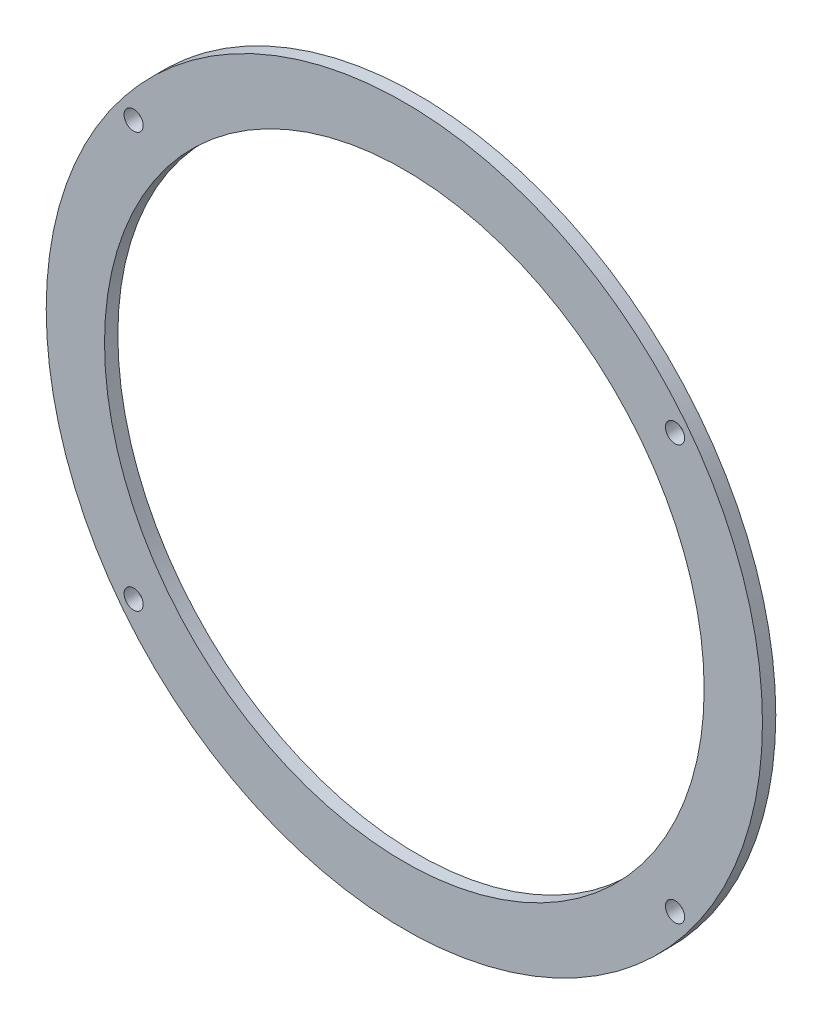
from build123d import *

# Parameters (mm, degrees)
SKETCH1_R           = 43
SKETCH1_R_2         = 36
SKETCH1_R_3         = 1.15
BOSS_EXTRUDE2_DEPTH = 1.6
SKETCH4_W           = 1.2
SKETCH4_H           = 2.3
BOSS_EXTRUDE3_DEPTH = 0.1


with BuildPart() as part:
    # Sketch1 → Boss-Extrude2 (new body)
    with BuildSketch(Plane.XY):
        Circle(SKETCH1_R)
        Circle(SKETCH1_R_2, mode=Mode.SUBTRACT)
        with Locations((32.5, -24.9)):
            Circle(SKETCH1_R_3, mode=Mode.SUBTRACT)
        with Locations((-32.5, -24.9)):
            Circle(SKETCH1_R_3, mode=Mode.SUBTRACT)
        with Locations((-32.5, 24.9)):
            Circle(SKETCH1_R_3, mode=Mode.SUBTRACT)
        with Locations((32.5, 24.9)):
            Circle(SKETCH1_R_3, mode=Mode.SUBTRACT)
    extrude(amount=BOSS_EXTRUDE2_DEPTH)

    # Sketch4 → Boss-Extrude3 (add)
    with BuildSketch(Plane(origin=(0, 0, 0), x_dir=(-1, 0, 0), z_dir=(0, 0, -1))):
        with Locations((1.3, 40.65)):
            Rectangle(SKETCH4_W, SKETCH4_H)
        with Locations((3.9, 40.65)):
            Rectangle(SKETCH4_W, SKETCH4_H)
        with Locations((-1.3, 40.65)):
            Rectangle(SKETCH4_W, SKETCH4_H)
        with Locations((-3.9, 40.65)):
            Rectangle(SKETCH4_W, SKETCH4_H)
    extrude(amount=BOSS_EXTRUDE3_DEPTH)


solid = part.part
